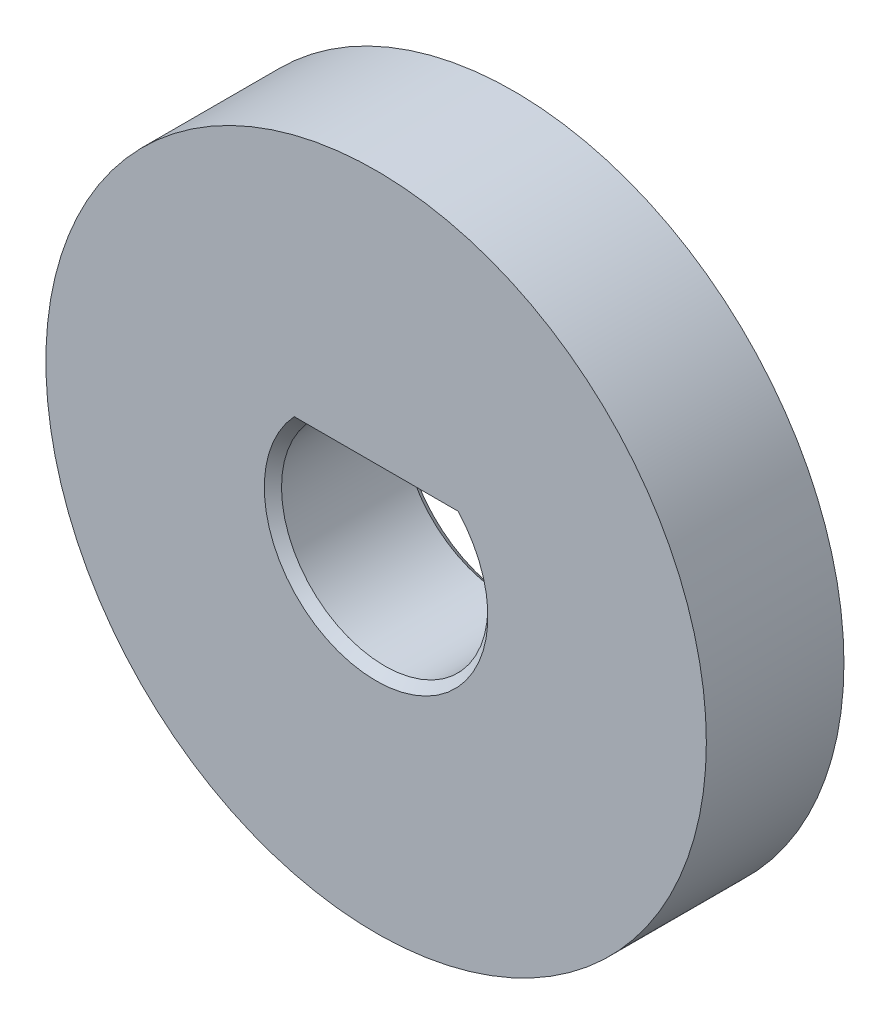
from build123d import *

# Parameters (mm, degrees)
SKETCH1_R           = 30.48
SKETCH1_R_2         = 9.525
EXTRUDE1_DEPTH      = 6.35
CHAMFER1_SIZE       = 0.79375
BOSS_EXTRUDE1_DEPTH = 12.7


with BuildPart() as part:
    # Sketch1 → Extrude1 (new, symmetric)
    with BuildSketch(Plane.XY):
        Circle(SKETCH1_R)
        Circle(SKETCH1_R_2, mode=Mode.SUBTRACT)
    extrude(amount=EXTRUDE1_DEPTH, both=True)

    # Chamfer1
    chamfer1_edges = [part.edges().sort_by_distance(p)[0] for p in [
        (-9.525, 0, -6.35),
        (-9.525, 0, 6.35),
    ]]
    chamfer(chamfer1_edges, length=CHAMFER1_SIZE)

    # Sketch3 → Boss-Extrude1 (add, through all)
    with BuildSketch(Plane(origin=(0, 0, -6.35), x_dir=(-1, 0, 0), z_dir=(0, 0, -1))):
        with BuildLine():
            ThreePointArc((7.558172832, 7.025), (0, 10.31875), (-7.558172832, 7.025))
            Line((-7.558172832, 7.025), (7.558172832, 7.025))
        make_face()
    extrude(amount=-BOSS_EXTRUDE1_DEPTH)


solid = part.part
